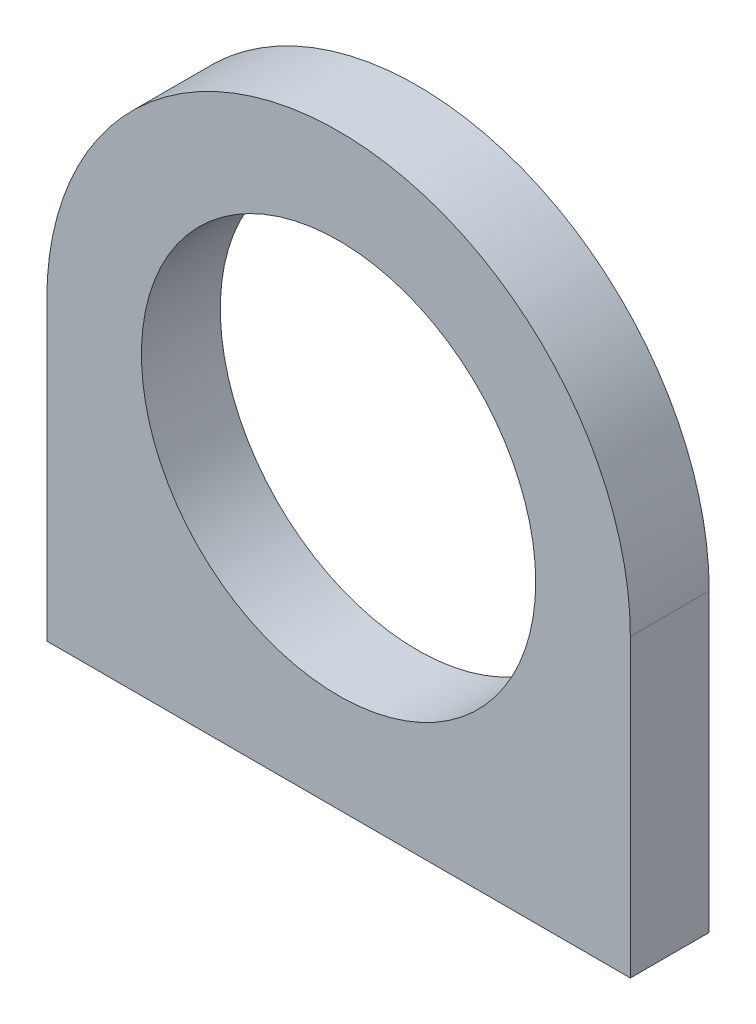
from build123d import *

# Parameters (mm, degrees)
BOSS_EXTRUDE1_DEPTH      = 2.5
BOSS_EXTRUDE1_DEPTH_BACK = 2.5
SKETCH1_R                = 12.5
SKETCH2_R                = 1.5
CUT_EXTRUDE1_DEPTH       = 10


with BuildPart() as part:
    # Sketch1 → Boss-Extrude1 (new, two sides: drawn at the far end of the back side and taken through both)
    with BuildSketch(Plane.XY.offset(-BOSS_EXTRUDE1_DEPTH_BACK)):
        with BuildLine():
            Line((18.5, -18.75), (18.5, 0))
            ThreePointArc((18.5, 0), (0, 18.5), (-18.5, 0))
            Line((-18.5, 0), (-18.5, -18.75))
            Line((-18.5, -18.75), (18.5, -18.75))
        make_face()
        Circle(SKETCH1_R, mode=Mode.SUBTRACT)
    extrude(amount=BOSS_EXTRUDE1_DEPTH + BOSS_EXTRUDE1_DEPTH_BACK)

    # Sketch2 → Cut-Extrude1 (cut)
    with BuildSketch(Plane.XZ.offset(18.75)):
        with Locations((-16, 0)):
            Circle(SKETCH2_R)
    cut_extrude1 = extrude(amount=-CUT_EXTRUDE1_DEPTH, mode=Mode.SUBTRACT)

    # Mirror1: Cut-Extrude1 across plane
    add(cut_extrude1.mirror(Plane(origin=(0, 0, 0), x_dir=(0, 0, 1), z_dir=(1, 0, 0))), mode=Mode.SUBTRACT)


solid = part.part
